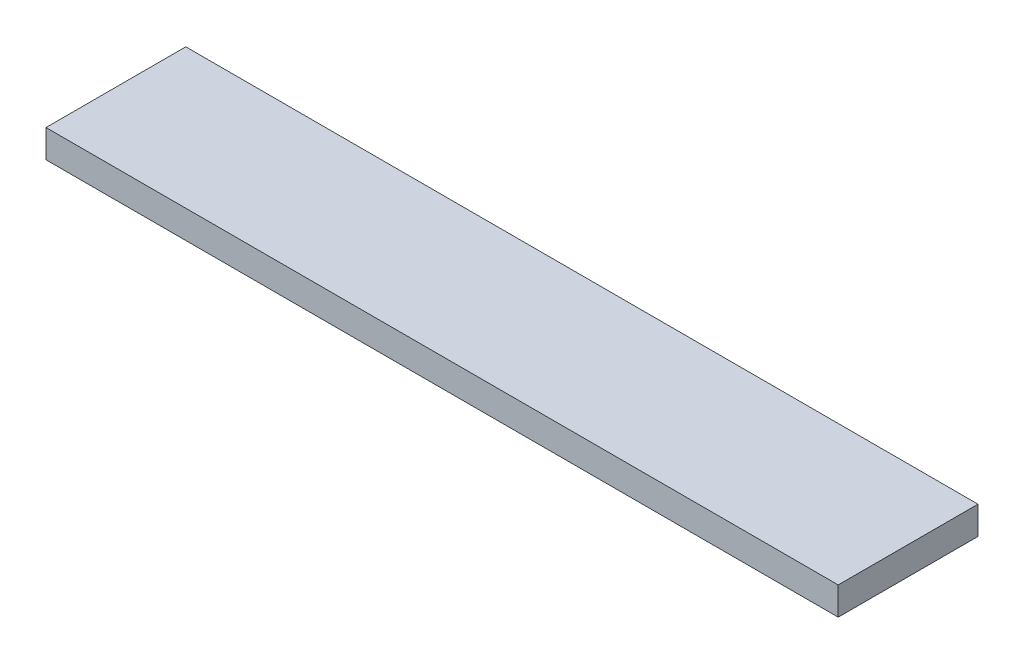
from build123d import *

# Parameters (mm, degrees)
ESBO_O1_W                = 340
ESBO_O1_H                = 60
RESSALTO_EXTRUS_O1_DEPTH = 12


with BuildPart() as part:
    # Esboço1 → Ressalto-extrusão1 (new body)
    with BuildSketch(Plane(origin=(0, 0, 0), x_dir=(1, 0, 0), z_dir=(0, 1, 0))):
        Rectangle(ESBO_O1_W, ESBO_O1_H)
    extrude(amount=RESSALTO_EXTRUS_O1_DEPTH)


solid = part.part
